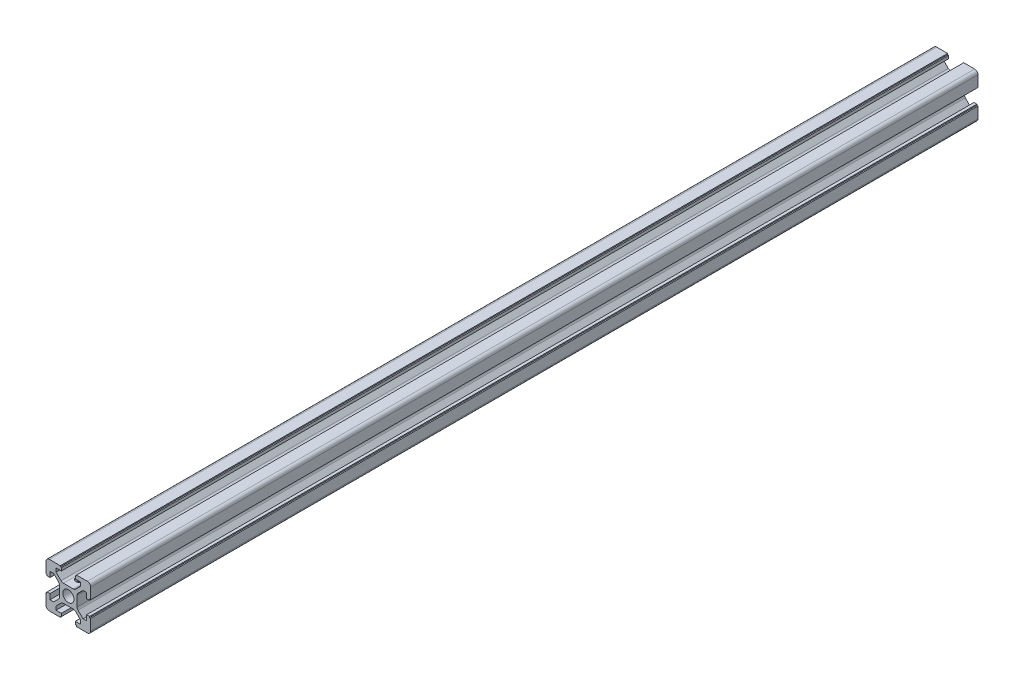
from build123d import *

# Parameters (mm, degrees)
SKETCH_1_R          = 2.5
EXTRUDE_1_DEPTH     = 198.5
SKETCH_3_R          = 1.6
CUT_EXTRUDE_1_DEPTH = 200.755475519


with BuildPart() as part:
    # 草图1 → 凸台-拉伸1 (new, symmetric)
    with BuildSketch(Plane.XY):
        with BuildLine():
            Line((-6.560660172, 5.5), (-4.339339828, 3.278679656))
            ThreePointArc((-4.339339828, 3.278679656), (-4.014180701, 2.792044633), (-3.9, 2.218019485))
            Line((-3.9, 2.218019485), (-3.9, -2.218019485))
            ThreePointArc((-3.9, -2.218019485), (-4.014180701, -2.792044633), (-4.339339828, -3.278679656))
            Line((-4.339339828, -3.278679656), (-6.560660172, -5.5))
            Line((-6.560660172, -5.5), (-8.2, -5.5))
            Line((-8.2, -5.5), (-8.2, -3.1))
            Line((-8.2, -3.1), (-9.5, -3.1))
            Line((-9.5, -3.1), (-9.5, -3.6))
            Line((-9.5, -3.6), (-10, -3.6))
            Line((-10, -3.6), (-10, -8.5))
            ThreePointArc((-10, -8.5), (-9.560660172, -9.560660172), (-8.5, -10))
            Line((-8.5, -10), (-3.6, -10))
            Line((-3.6, -10), (-3.6, -9.5))
            Line((-3.6, -9.5), (-3.1, -9.5))
            Line((-3.1, -9.5), (-3.1, -8.2))
            Line((-3.1, -8.2), (-5.5, -8.2))
            Line((-5.5, -8.2), (-5.5, -6.560660172))
            Line((-5.5, -6.560660172), (-3.278679656, -4.339339828))
            ThreePointArc((-3.278679656, -4.339339828), (-2.792044633, -4.014180701), (-2.218019485, -3.9))
            Line((-2.218019485, -3.9), (2.218019485, -3.9))
            ThreePointArc((2.218019485, -3.9), (2.792044633, -4.014180701), (3.278679656, -4.339339828))
            Line((3.278679656, -4.339339828), (5.5, -6.560660172))
            Line((5.5, -6.560660172), (5.5, -8.2))
            Line((5.5, -8.2), (3.1, -8.2))
            Line((3.1, -8.2), (3.1, -9.5))
            Line((3.1, -9.5), (3.6, -9.5))
            Line((3.6, -9.5), (3.6, -10))
            Line((3.6, -10), (8.5, -10))
            ThreePointArc((8.5, -10), (9.560660172, -9.560660172), (10, -8.5))
            Line((10, -8.5), (10, -3.6))
            Line((10, -3.6), (9.5, -3.6))
            Line((9.5, -3.6), (9.5, -3.1))
            Line((9.5, -3.1), (8.2, -3.1))
            Line((8.2, -3.1), (8.2, -5.5))
            Line((8.2, -5.5), (6.560660172, -5.5))
            Line((6.560660172, -5.5), (4.339339828, -3.278679656))
            ThreePointArc((4.339339828, -3.278679656), (4.014180701, -2.792044633), (3.9, -2.218019485))
            Line((3.9, -2.218019485), (3.9, 2.218019485))
            ThreePointArc((3.9, 2.218019485), (4.014180701, 2.792044633), (4.339339828, 3.278679656))
            Line((4.339339828, 3.278679656), (6.560660172, 5.5))
            Line((6.560660172, 5.5), (8.2, 5.5))
            Line((8.2, 5.5), (8.2, 3.1))
            Line((8.2, 3.1), (9.5, 3.1))
            Line((9.5, 3.1), (9.5, 3.6))
            Line((9.5, 3.6), (10, 3.6))
            Line((10, 3.6), (10, 8.5))
            ThreePointArc((10, 8.5), (9.560660172, 9.560660172), (8.5, 10))
            Line((8.5, 10), (3.6, 10))
            Line((3.6, 10), (3.6, 9.5))
            Line((3.6, 9.5), (3.1, 9.5))
            Line((3.1, 9.5), (3.1, 8.2))
            Line((3.1, 8.2), (5.5, 8.2))
            Line((5.5, 8.2), (5.5, 6.560660172))
            Line((5.5, 6.560660172), (3.278679656, 4.339339828))
            ThreePointArc((3.278679656, 4.339339828), (2.792044633, 4.014180701), (2.218019485, 3.9))
            Line((2.218019485, 3.9), (-2.218019485, 3.9))
            ThreePointArc((-2.218019485, 3.9), (-2.792044633, 4.014180701), (-3.278679656, 4.339339828))
            Line((-3.278679656, 4.339339828), (-5.5, 6.560660172))
            Line((-5.5, 6.560660172), (-5.5, 8.2))
            Line((-5.5, 8.2), (-3.1, 8.2))
            Line((-3.1, 8.2), (-3.1, 9.5))
            Line((-3.1, 9.5), (-3.6, 9.5))
            Line((-3.6, 9.5), (-3.6, 10))
            Line((-3.6, 10), (-8.5, 10))
            ThreePointArc((-8.5, 10), (-9.560660172, 9.560660172), (-10, 8.5))
            Line((-10, 8.5), (-10, 3.6))
            Line((-10, 3.6), (-9.5, 3.6))
            Line((-9.5, 3.6), (-9.5, 3.1))
            Line((-9.5, 3.1), (-8.2, 3.1))
            Line((-8.2, 3.1), (-8.2, 5.5))
            Line((-8.2, 5.5), (-6.560660172, 5.5))
        make_face()
        Circle(SKETCH_1_R, mode=Mode.SUBTRACT)
    extrude(amount=EXTRUDE_1_DEPTH, both=True)

    # 草图3 → 切除-拉伸1 (cut, through all)
    with BuildSketch(Plane(origin=(0, 10, 0), x_dir=(1, 0, 0), z_dir=(0, 1, 0))):
        with Locations(Location((0, 193.5, 0), (0, 0, 270))):
            Circle(SKETCH_3_R)
        with Locations(Location((0, 173.5, 0), (0, 0, 270))):
            Circle(SKETCH_3_R)
        with Locations(Location((0, -193.5, 0), (0, 0, 270))):
            Circle(SKETCH_3_R)
        with Locations(Location((0, -173.5, 0), (0, 0, 270))):
            Circle(SKETCH_3_R)
    extrude(amount=-CUT_EXTRUDE_1_DEPTH, mode=Mode.SUBTRACT)


solid = part.part
